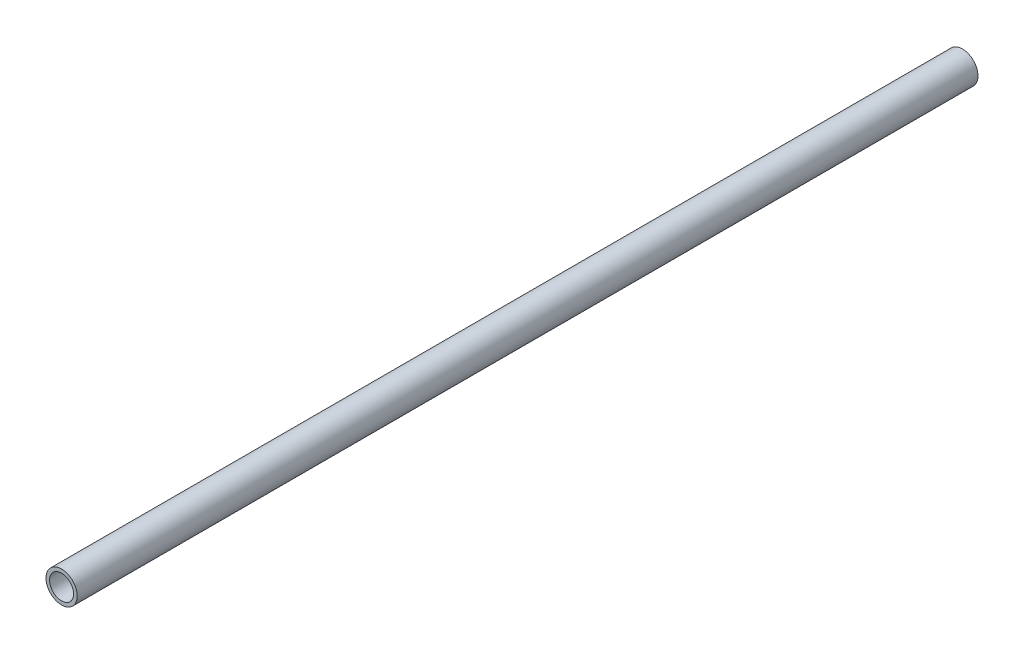
from build123d import *

# Parameters (mm, degrees)
SKETCH1_R           = 16.51
SKETCH1_R_2         = 12.7
BOSS_EXTRUDE1_DEPTH = 952.5


with BuildPart() as part:
    # Sketch1 → Boss-Extrude1 (new body)
    with BuildSketch(Plane.XY):
        Circle(SKETCH1_R)
        Circle(SKETCH1_R_2, mode=Mode.SUBTRACT)
    extrude(amount=BOSS_EXTRUDE1_DEPTH)


solid = part.part
